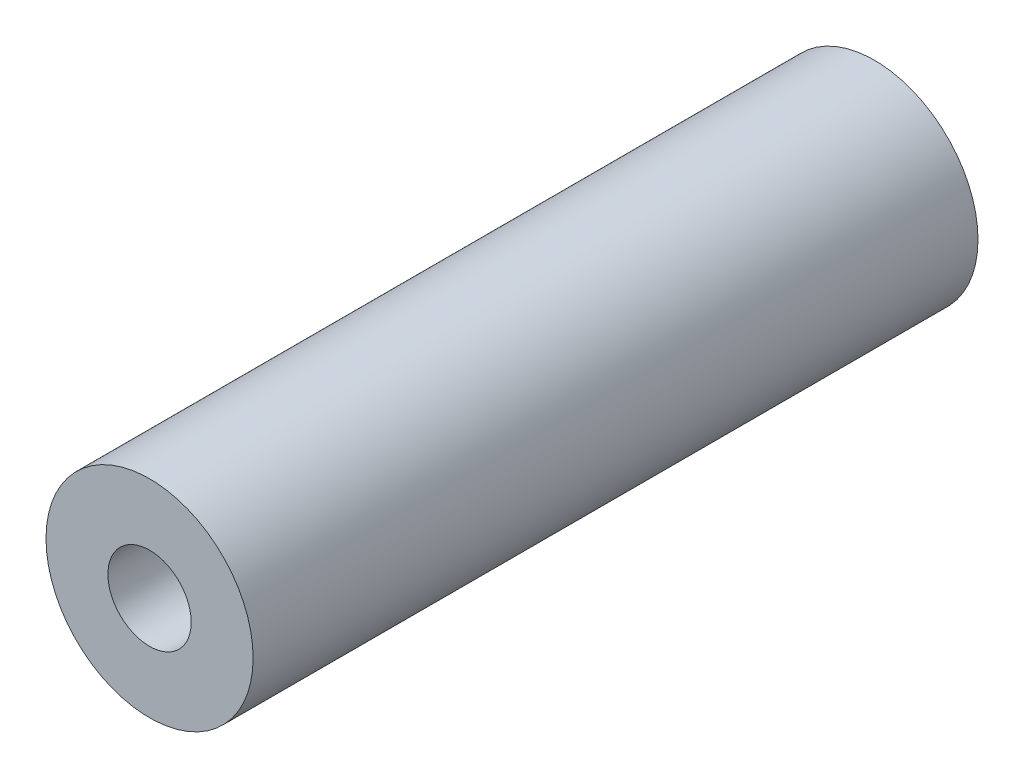
from build123d import *

# Parameters (mm, degrees)
SKETCH1_R           = 6.35
SKETCH1_R_2         = 2.555
BOSS_EXTRUDE1_DEPTH = 44.45


with BuildPart() as part:
    # Sketch1 → Boss-Extrude1 (new body)
    with BuildSketch(Plane.XY):
        Circle(SKETCH1_R)
        Circle(SKETCH1_R_2, mode=Mode.SUBTRACT)
    extrude(amount=BOSS_EXTRUDE1_DEPTH)


solid = part.part
